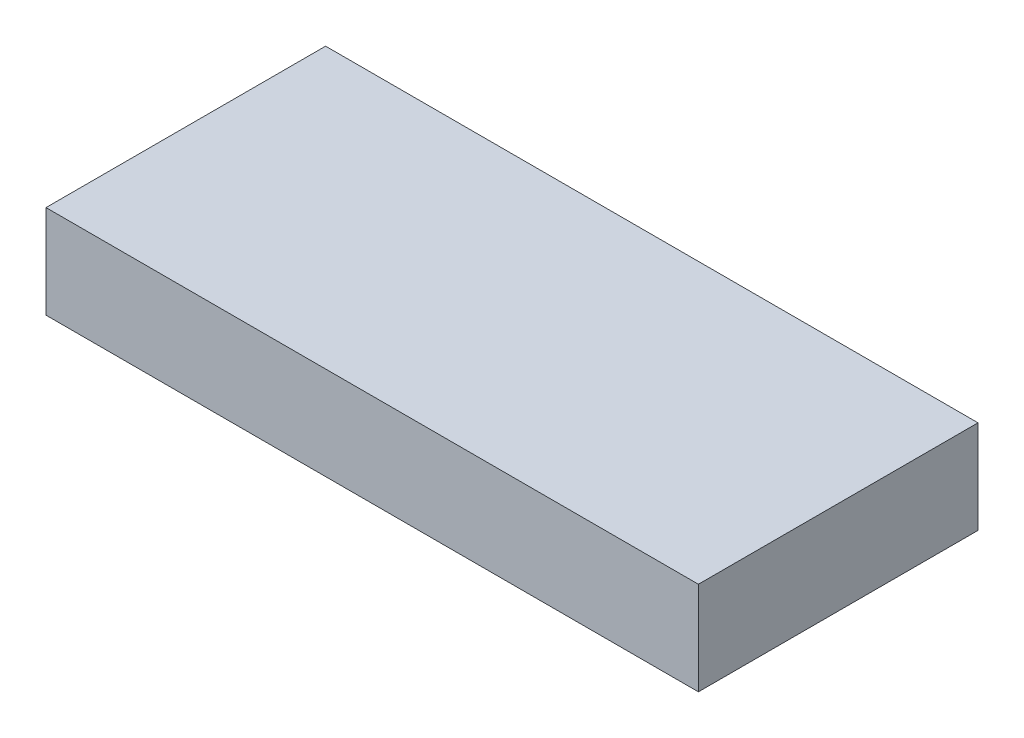
from build123d import *

# Parameters (mm, degrees)
SKETCH1_W           = 44.45
SKETCH1_H           = 19.05
BOSS_EXTRUDE1_DEPTH = 6.35


with BuildPart() as part:
    # Sketch1 → Boss-Extrude1 (new body)
    with BuildSketch(Plane(origin=(0, 0, 0), x_dir=(1, 0, 0), z_dir=(0, 1, 0))):
        Rectangle(SKETCH1_W, SKETCH1_H)
    extrude(amount=BOSS_EXTRUDE1_DEPTH)


solid = part.part
